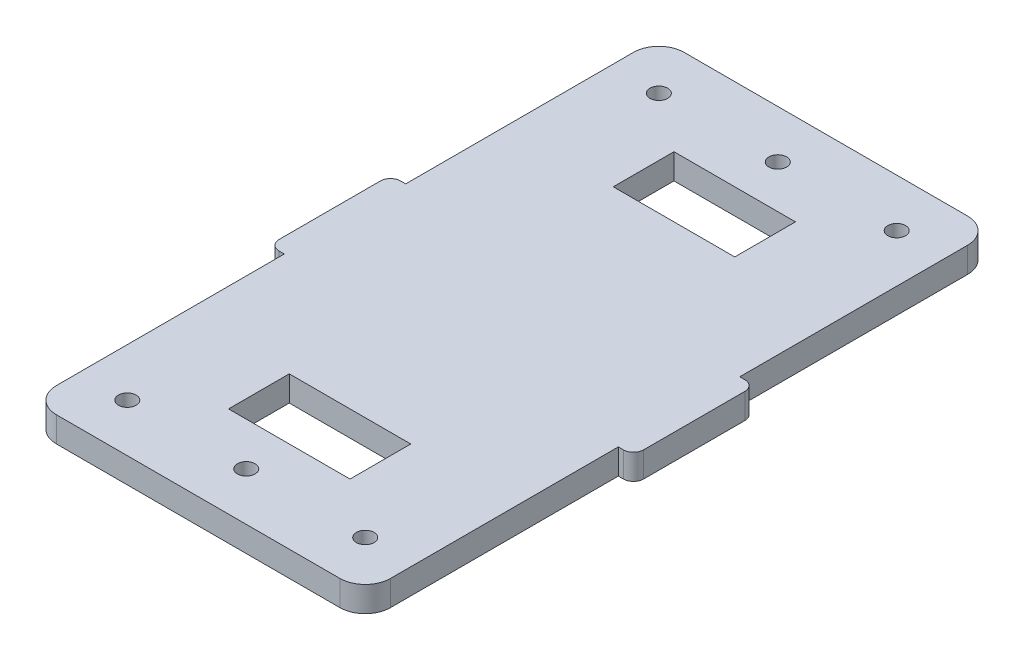
from build123d import *

# Parameters (mm, degrees)
SKETCH_1_W               = 72
SKETCH_1_H               = 100
EXTRUDE_1_DEPTH          = 5
SKETCH_2_W               = 72
SKETCH_2_H               = 5
EXTRUDE_2_DEPTH          = 24
CUT_EXTRUDE_1_DEPTH      = 83.443920334
CUT_EXTRUDE_1_DEPTH_BACK = 83.443920334
SKETCH_3_W               = 3
SKETCH_3_H               = 50
CUT_EXTRUDE_2_DEPTH      = 83.443920334
CUT_EXTRUDE_2_DEPTH_BACK = 83.443920334
SKETCH_5_R               = 1.75
CUT_EXTRUDE_3_DEPTH      = 83.443920334
CUT_EXTRUDE_3_DEPTH_BACK = 83.443920334
SKETCH_6_R               = 1.75
CUT_EXTRUDE_4_DEPTH      = 83.443920334
CUT_EXTRUDE_4_DEPTH_BACK = 83.443920334
SKETCH_7_W               = 24
SKETCH_7_H               = 12
FILLET_1_R               = 5
FILLET_2_R               = 2
CUT_EXTRUDE_5_DEPTH      = 83.443920334
CUT_EXTRUDE_5_DEPTH_BACK = 83.443920334
SKETCH_8_R               = 1.75


with BuildPart() as part:
    # 草图1 → 凸台-拉伸1 (new body)
    with BuildSketch(Plane(origin=(0, 0, 0), x_dir=(1, 0, 0), z_dir=(0, 1, 0))):
        Rectangle(SKETCH_1_W, SKETCH_1_H)
    extrude(amount=EXTRUDE_1_DEPTH)

    # 草图2 → 凸台-拉伸2 (add)
    with BuildSketch(Plane.XY.offset(50)):
        with Locations((0, 2.5)):
            Rectangle(SKETCH_2_W, SKETCH_2_H)
    extrude(amount=EXTRUDE_2_DEPTH)

    # 草图3 → 切除-拉伸1 (cut, two sides: drawn at the far end of the back side and taken through both)
    with BuildSketch(Plane(origin=(0, 5, 0), x_dir=(1, 0, 0), z_dir=(0, 1, 0)).offset(-CUT_EXTRUDE_1_DEPTH_BACK)):
        with Locations((-34.5, 25)):
            Rectangle(SKETCH_3_W, SKETCH_3_H)
        with Locations((34.5, 25)):
            Rectangle(SKETCH_3_W, SKETCH_3_H)
        with Locations((-34.5, -49)):
            Rectangle(SKETCH_3_W, SKETCH_3_H)
        with Locations((34.5, -49)):
            Rectangle(SKETCH_3_W, SKETCH_3_H)
    extrude(amount=CUT_EXTRUDE_1_DEPTH + CUT_EXTRUDE_1_DEPTH_BACK, mode=Mode.SUBTRACT)

    # 草图5 → 切除-拉伸2 (cut, two sides: drawn at the far end of the back side and taken through both)
    with BuildSketch(Plane(origin=(0, 5, 0), x_dir=(1, 0, 0), z_dir=(0, 1, 0)).offset(-CUT_EXTRUDE_2_DEPTH_BACK)):
        with Locations(Location((-23.5, 40.5, 0), (0, 0, 270))):
            Circle(SKETCH_5_R)
    extrude(amount=CUT_EXTRUDE_2_DEPTH + CUT_EXTRUDE_2_DEPTH_BACK, mode=Mode.SUBTRACT)

    # 草图6 → 切除-拉伸3 (cut, two sides: drawn at the far end of the back side and taken through both)
    with BuildSketch(Plane(origin=(0, 5, 0), x_dir=(1, 0, 0), z_dir=(0, 1, 0)).offset(-CUT_EXTRUDE_3_DEPTH_BACK)):
        with Locations(Location((23.5, 40.5, 0), (0, 0, 270))):
            Circle(SKETCH_6_R)
        with Locations(Location((-23.5, -64.5, 0), (0, 0, 270))):
            Circle(SKETCH_6_R)
        with Locations(Location((23.5, -64.5, 0), (0, 0, 270))):
            Circle(SKETCH_6_R)
    extrude(amount=CUT_EXTRUDE_3_DEPTH + CUT_EXTRUDE_3_DEPTH_BACK, mode=Mode.SUBTRACT)

    # 草图7 → 切除-拉伸4 (cut, two sides: drawn at the far end of the back side and taken through both)
    with BuildSketch(Plane(origin=(0, 5, 0), x_dir=(1, 0, 0), z_dir=(0, 1, 0)).offset(-CUT_EXTRUDE_4_DEPTH_BACK)):
        with Locations((0, -50)):
            Rectangle(SKETCH_7_W, SKETCH_7_H)
        with Locations((0, 26)):
            Rectangle(SKETCH_7_W, SKETCH_7_H)
    extrude(amount=CUT_EXTRUDE_4_DEPTH + CUT_EXTRUDE_4_DEPTH_BACK, mode=Mode.SUBTRACT)

    # 圆角1
    fillet_1_edges = [part.edges().sort_by_distance(p)[0] for p in [
        (33, 2.5, -50),
        (-33, 2.5, 74),
        (33, 2.5, 74),
        (-33, 2.5, -50),
    ]]
    fillet(fillet_1_edges, radius=FILLET_1_R)

    # 圆角2
    fillet_2_edges = [part.edges().sort_by_distance(p)[0] for p in [
        (36, 2.5, 0),
        (-36, 2.5, 24),
        (36, 2.5, 24),
        (-36, 2.5, 0),
    ]]
    fillet(fillet_2_edges, radius=FILLET_2_R)

    # 草图8 → 切除-拉伸5 (cut, two sides: drawn at the far end of the back side and taken through both)
    with BuildSketch(Plane(origin=(0, 5, 0), x_dir=(1, 0, 0), z_dir=(0, 1, 0)).offset(-CUT_EXTRUDE_5_DEPTH_BACK)):
        with Locations(Location((0, 40.5, 0), (0, 0, 270))):
            Circle(SKETCH_8_R)
        with Locations(Location((0, -64.5, 0), (0, 0, 270))):
            Circle(SKETCH_8_R)
    extrude(amount=CUT_EXTRUDE_5_DEPTH + CUT_EXTRUDE_5_DEPTH_BACK, mode=Mode.SUBTRACT)


solid = part.part
